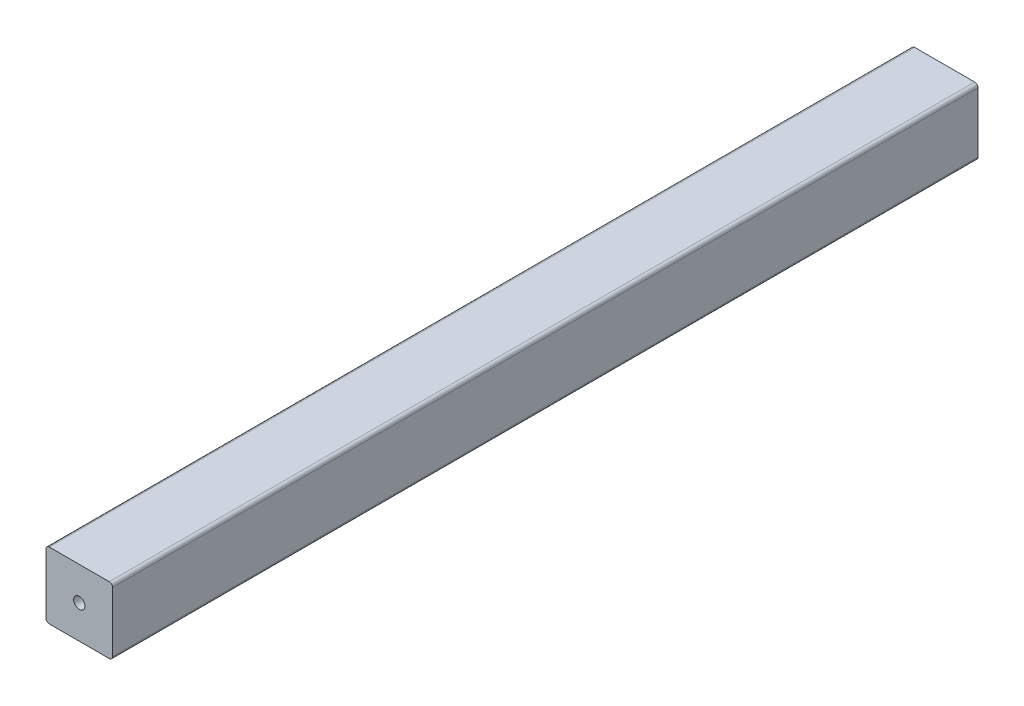
from build123d import *

# Parameters (mm, degrees)
SKETCH1_W           = 40
SKETCH1_H           = 40
SKETCH1_R           = 2.5
BOSS_EXTRUDE1_DEPTH = 260
FILLET1_R           = 2


with BuildPart() as part:
    # Sketch1 → Boss-Extrude1 (new, symmetric)
    with BuildSketch(Plane.XY):
        Rectangle(SKETCH1_W, SKETCH1_H)
        Circle(SKETCH1_R, mode=Mode.SUBTRACT)
    extrude(amount=BOSS_EXTRUDE1_DEPTH, both=True)

    # Fillet1
    fillet1_edges = [part.edges().sort_by_distance(p)[0] for p in [
        (20, -20, 0),
        (-20, -20, 0),
        (-20, 20, 0),
        (20, 20, 0),
    ]]
    fillet(fillet1_edges, radius=FILLET1_R)

    # Sketch9 → M8 Tapped Hole1 (revolve, cut)
    with BuildSketch(Plane(origin=(0, 0, 260), x_dir=(0, -1, 0), z_dir=(1, 0, 0))):
        Polygon((0, 0), (0, 29.792926105), (3.4, 27.75), (3.4, 0), align=None)
    m8_tapped_hole1 = revolve(axis=Axis((0, 0, 266.35), (0, 0, -1)), mode=Mode.SUBTRACT)

    # Mirror1: M8 Tapped Hole1 across plane
    add(m8_tapped_hole1.mirror(Plane.XY), mode=Mode.SUBTRACT)


solid = part.part
